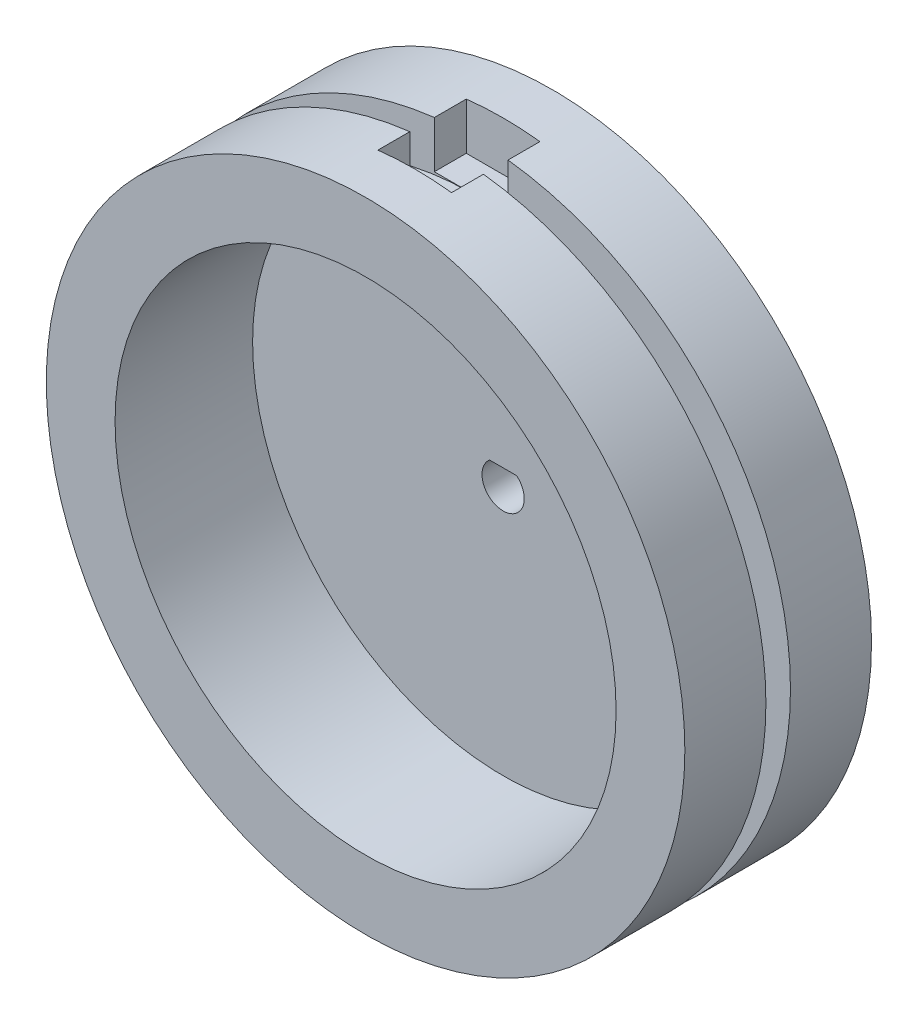
from build123d import *

# Parameters (mm, degrees)
SKETCH7_W          = 7.5
SKETCH7_H          = 9
CUT_EXTRUDE1_DEPTH = 5
SHAFT_HOLE_DEPTH   = 50.734294003


with BuildPart() as part:
    # Sketch2 → Revolve1 (revolve)
    with BuildSketch(Plane(origin=(0, 0, 0), x_dir=(0, 0, -1), z_dir=(1, 0, 0)), mode=Mode.PRIVATE) as revolve1_sk:
        Polygon((0, 0), (0, 32.5), (-8.25, 32.5), (-8.25, 27.5), (-10.75, 27.5), (-10.75, 32.5), (-19, 32.5), (-19, 25.5), (-5, 25.5), (-5, 0), align=None)
    revolve(revolve1_sk.sketch.rotate(Axis((0, 0, 5), (0, 0, -1)), 90), axis=Axis((0, 0, 5), (0, 0, -1)))

    # Sketch7 → Cut-Extrude1 (cut)
    with BuildSketch(Plane(origin=(0, 32.5, 0), x_dir=(1, 0, 0), z_dir=(0, 1, 0))):
        with Locations((0, -9.5)):
            Rectangle(SKETCH7_W, SKETCH7_H)
    cut_extrude1 = extrude(amount=-CUT_EXTRUDE1_DEPTH, mode=Mode.SUBTRACT)

    # Mirror1: Cut-Extrude1 across plane
    add(cut_extrude1.mirror(Plane.ZX), mode=Mode.SUBTRACT)

    # Sketch8 → Shaft Hole (cut, through all)
    with BuildSketch(Plane(origin=(0, 0, 0), x_dir=(-1, 0, 0), z_dir=(0, 0, -1))):
        with BuildLine():
            Line((-1.378404875, 1.65), (1.378404875, 1.65))
            ThreePointArc((1.378404875, 1.65), (0, -2.15), (-1.378404875, 1.65))
        make_face()
    extrude(amount=-SHAFT_HOLE_DEPTH, mode=Mode.SUBTRACT)


solid = part.part
